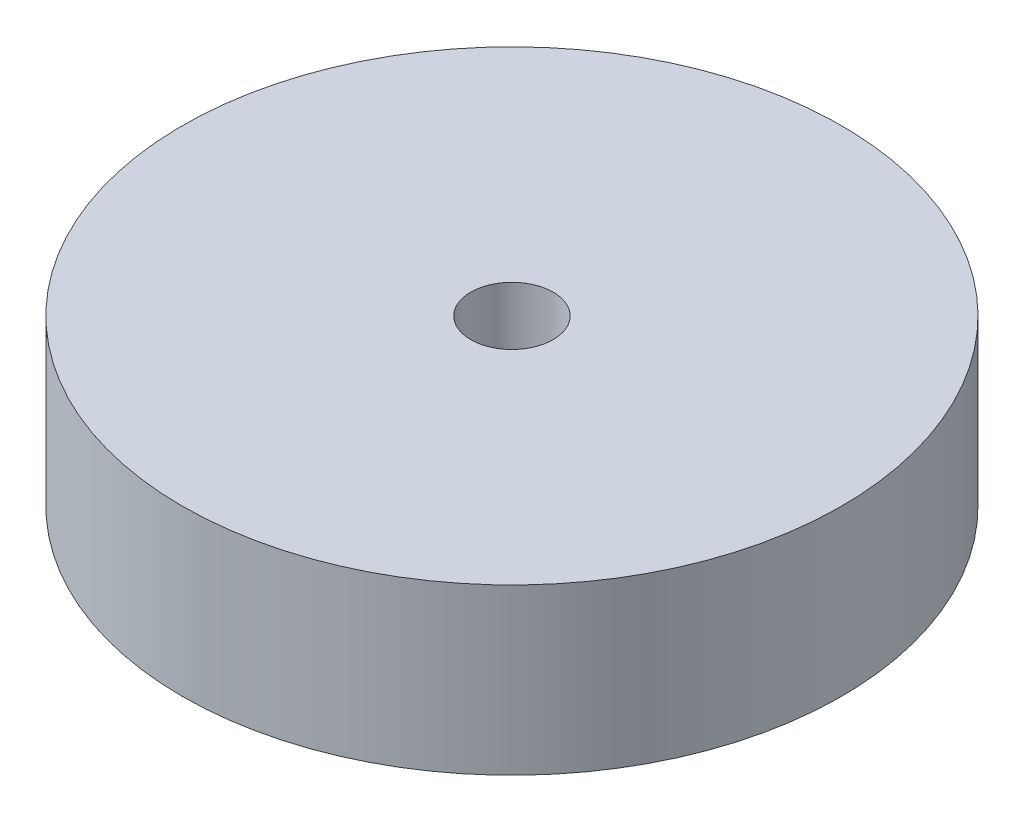
from build123d import *

# Parameters (mm, degrees)
SKETCH1_R           = 101.6
SKETCH1_R_2         = 12.7
BOSS_EXTRUDE1_DEPTH = 50.8


with BuildPart() as part:
    # Sketch1 → Boss-Extrude1 (new body)
    with BuildSketch(Plane(origin=(0, 0, 0), x_dir=(1, 0, 0), z_dir=(0, 1, 0))):
        with Locations(Location((0, 0, 0), (0, 0, 270))):
            Circle(SKETCH1_R)
        with Locations(Location((0, 0, 0), (0, 0, 270))):
            Circle(SKETCH1_R_2, mode=Mode.SUBTRACT)
    extrude(amount=BOSS_EXTRUDE1_DEPTH)


solid = part.part
